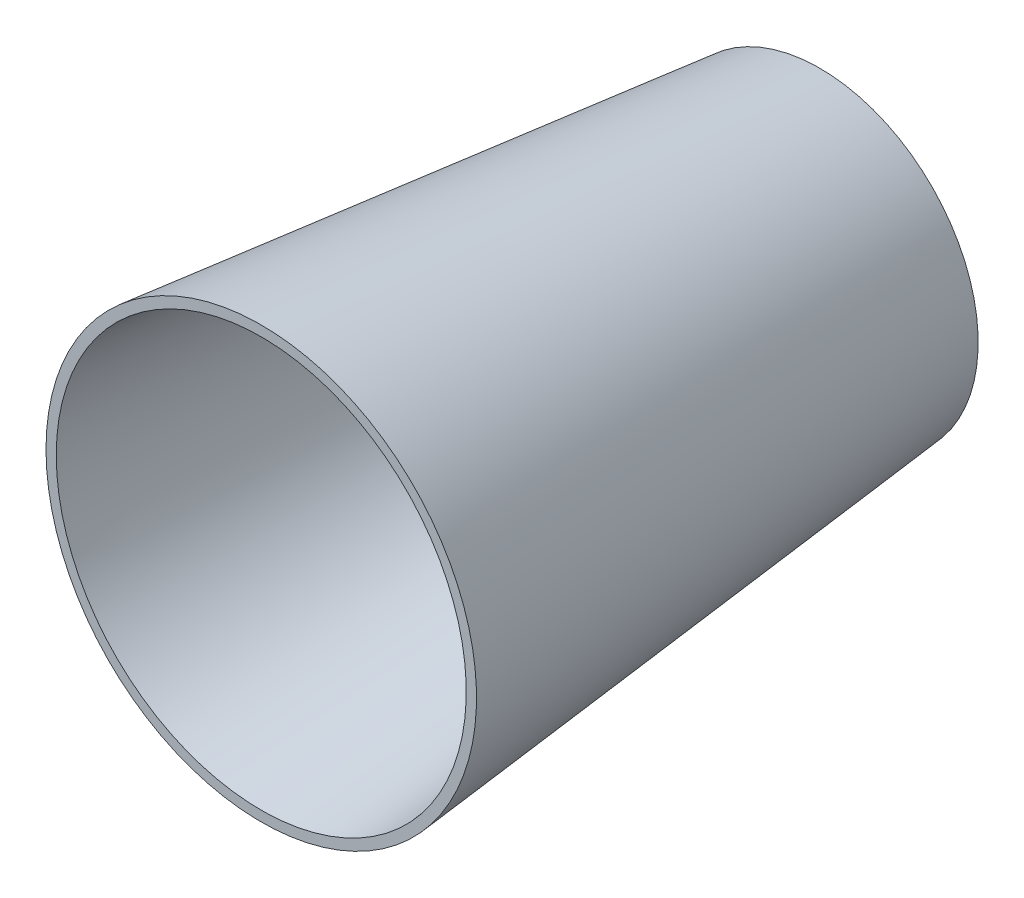
from build123d import *


with BuildPart() as part:
    # Sketch2 → Revolve1 (revolve)
    with BuildSketch(Plane(origin=(0, 0, 0), x_dir=(0, 0, -1), z_dir=(1, 0, 0)), mode=Mode.PRIVATE) as revolve1_sk:
        Polygon((-33.878273333, 481.335355706), (-34.121689051, 481.335355706), (-34.121689051, 512.835355706), (47.621726667, 504.499283346), (47.621726667, 481.499283346), (46.121726667, 481.335355706), align=None)
    revolve(revolve1_sk.sketch.rotate(Axis((0, 481.335355706, -46.121726667), (0, 0, 1)), 90), axis=Axis((0, 481.335355706, -46.121726667), (0, 0, 1)))

    # Sketch3 → Cut-Revolve1 (revolve, cut)
    with BuildSketch(Plane(origin=(0, 0, 0), x_dir=(0, 0, -1), z_dir=(1, 0, 0)), mode=Mode.PRIVATE) as cut_revolve1_sk:
        Polygon((-34.121689051, 511.335355706), (46.130710997, 503.177695366), (46.130710997, 481.335355706), (-34.121689051, 481.335355706), align=None)
    revolve(cut_revolve1_sk.sketch.rotate(Axis((0, 481.335355706, -46.121726667), (0, 0, 1)), 90), axis=Axis((0, 481.335355706, -46.121726667), (0, 0, 1)), mode=Mode.SUBTRACT)


solid = part.part
